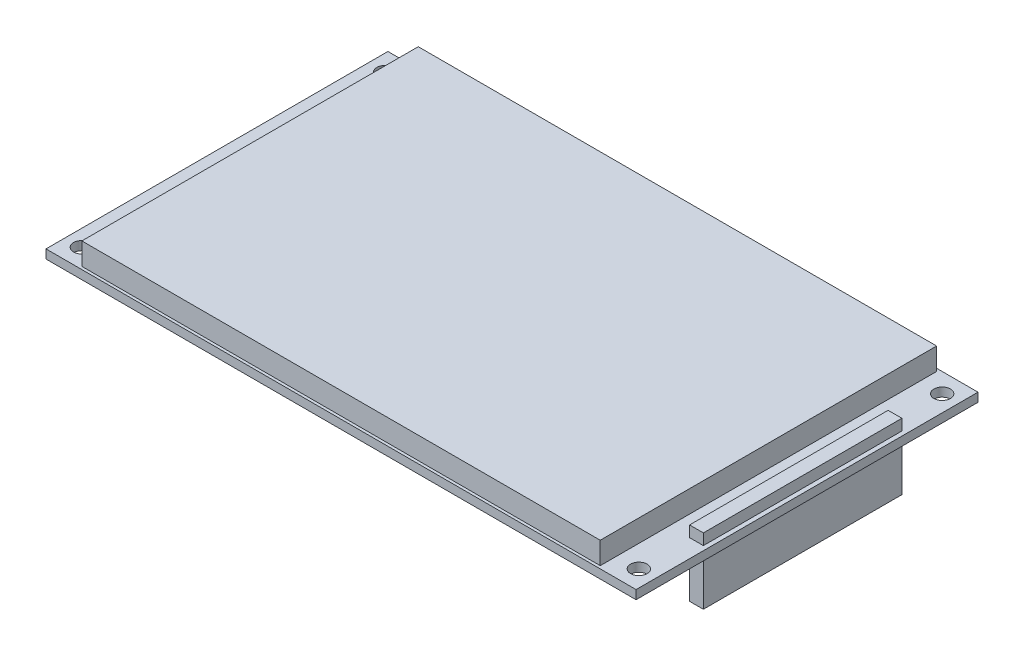
from build123d import *

# Parameters (mm, degrees)
SCHIZZO1_W                        = 94
SCHIZZO1_H                        = 61
ESTRUSIONE_ESTRUSIONE1_DEPTH      = 4
SCHIZZO2_W                        = 107
SCHIZZO2_H                        = 62
ESTRUSIONE_ESTRUSIONE2_DEPTH      = 1.6
ESTRUSIONE_ESTRUSIONE3_DEPTH      = 2
ESTRUSIONE_ESTRUSIONE3_DEPTH_BACK = 10
SCHIZZO4_W                        = 2.5
SCHIZZO4_H                        = 36
SCHIZZO6_R                        = 1.5
TAGLIO_ESTRUSIONE1_DEPTH          = 2
SCHIZZO7_W                        = 27
SCHIZZO7_H                        = 17
ESTRUSIONE_ESTRUSIONE4_DEPTH      = 3


with BuildPart() as part:
    # Schizzo1 → Estrusione-Estrusione1 (new body)
    with BuildSketch(Plane(origin=(0, 0, 0), x_dir=(1, 0, 0), z_dir=(0, 1, 0))):
        Rectangle(SCHIZZO1_W, SCHIZZO1_H)
    extrude(amount=ESTRUSIONE_ESTRUSIONE1_DEPTH)

    # Schizzo2 → Estrusione-Estrusione2 (add)
    with BuildSketch(Plane.XZ):
        with Locations((0.5, 0)):
            Rectangle(SCHIZZO2_W, SCHIZZO2_H)
    extrude(amount=ESTRUSIONE_ESTRUSIONE2_DEPTH)

    # Schizzo4 → Estrusione-Estrusione3 (add, two sides: drawn at the far end of the back side and taken through both)
    with BuildSketch(Plane(origin=(0, 0, 0), x_dir=(1, 0, 0), z_dir=(0, 1, 0)).offset(-ESTRUSIONE_ESTRUSIONE3_DEPTH_BACK)):
        with Locations((51.95, 0)):
            Rectangle(SCHIZZO4_W, SCHIZZO4_H)
    extrude(amount=ESTRUSIONE_ESTRUSIONE3_DEPTH + ESTRUSIONE_ESTRUSIONE3_DEPTH_BACK)

    # Schizzo6 → Taglio-Estrusione1 (cut)
    with BuildSketch(Plane(origin=(0, 0, 0), x_dir=(1, 0, 0), z_dir=(0, 1, 0))):
        with Locations(Location((-50, 27.5, 0), (0, 0, 270))):
            Circle(SCHIZZO6_R)
        with Locations(Location((-50, -27.5, 0), (0, 0, 270))):
            Circle(SCHIZZO6_R)
        with Locations(Location((51, 27.5, 0), (0, 0, 270))):
            Circle(SCHIZZO6_R)
        with Locations(Location((51, -27.5, 0), (0, 0, 270))):
            Circle(SCHIZZO6_R)
    extrude(amount=-TAGLIO_ESTRUSIONE1_DEPTH, mode=Mode.SUBTRACT)

    # Schizzo7 → Estrusione-Estrusione4 (add)
    with BuildSketch(Plane.XZ.offset(1.6)):
        with Locations((-11.5, 18)):
            Rectangle(SCHIZZO7_W, SCHIZZO7_H)
    extrude(amount=ESTRUSIONE_ESTRUSIONE4_DEPTH)


solid = part.part
